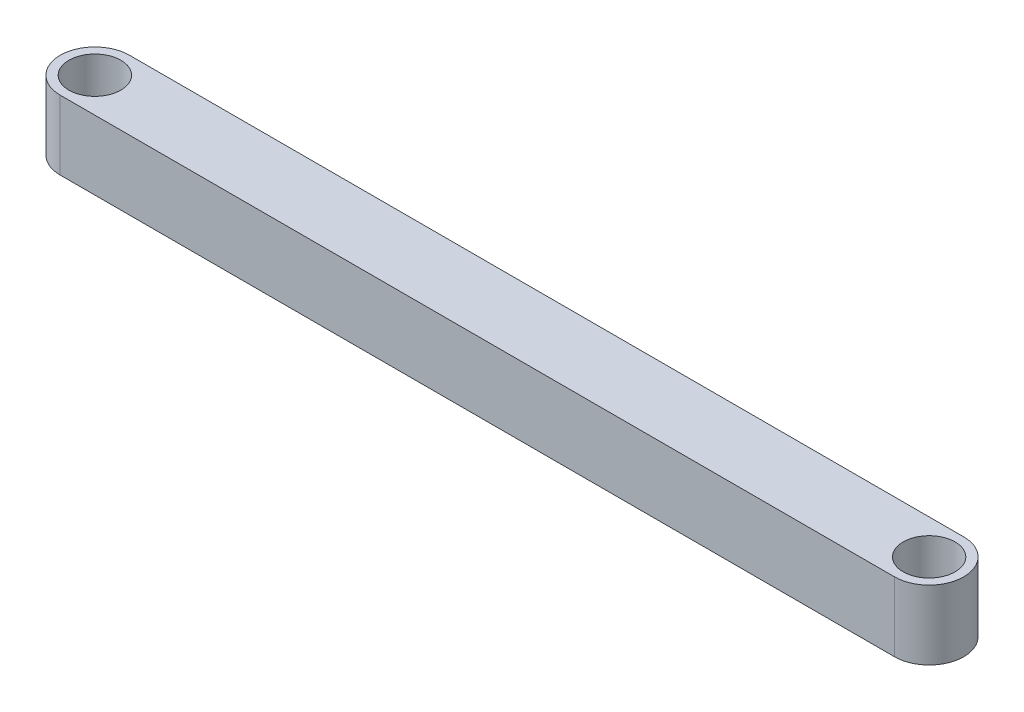
from build123d import *

# Parameters (mm, degrees)
SKETCH_1_R      = 15
EXTRUDE_1_DEPTH = 40


with BuildPart() as part:
    # 草图1 → 凸台-拉伸1 (new body)
    with BuildSketch(Plane(origin=(0, 0, 0), x_dir=(1, 0, 0), z_dir=(0, 1, 0))):
        with BuildLine():
            Line((0, 20), (482, 20))
            ThreePointArc((482, 20), (502, 0), (482, -20))
            Line((482, -20), (0, -20))
            ThreePointArc((0, -20), (-20, 0), (0, 20))
        make_face()
        with Locations(Location((0, 0, 0), (0, 0, 270))):
            Circle(SKETCH_1_R, mode=Mode.SUBTRACT)
        with Locations(Location((482, 0, 0), (0, 0, 270))):
            Circle(SKETCH_1_R, mode=Mode.SUBTRACT)
    extrude(amount=EXTRUDE_1_DEPTH)


solid = part.part
